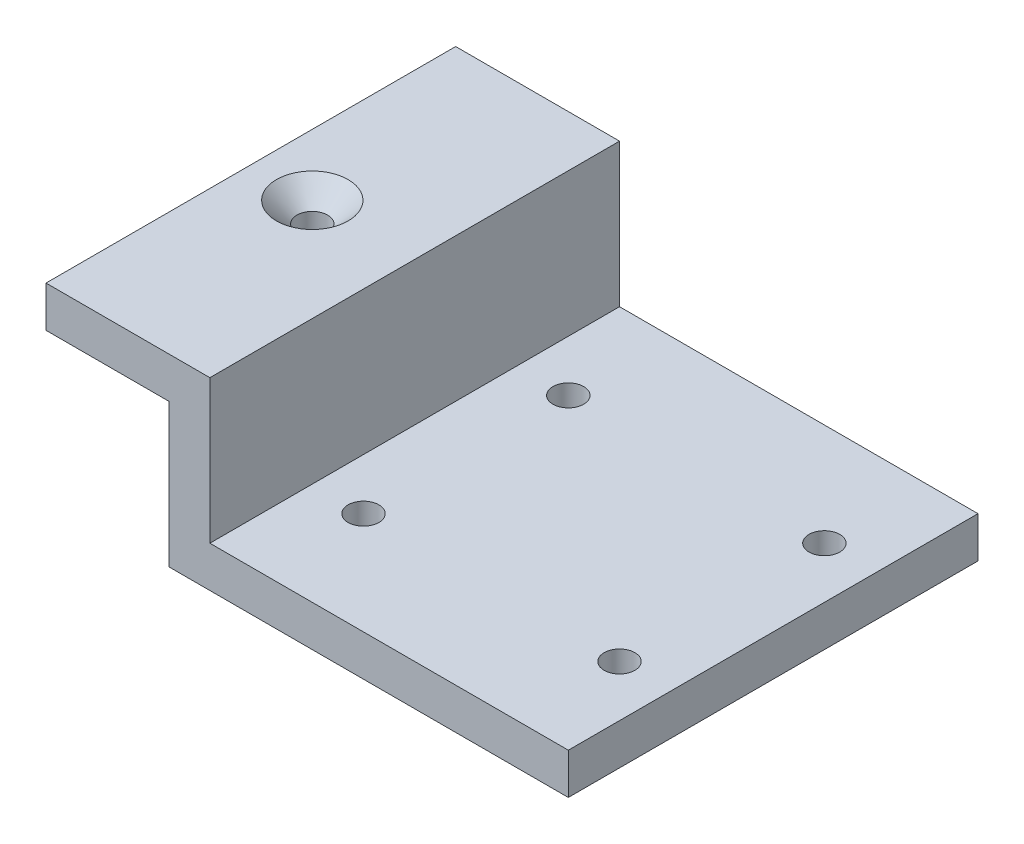
from build123d import *

# Parameters (mm, degrees)
SKETCH_1_W          = 35
SKETCH_1_H          = 40
SKETCH_1_R          = 1.5
EXTRUDE_1_DEPTH     = 4
SKETCH_2_W          = 40
SKETCH_2_H          = 18
EXTRUDE_2_DEPTH     = 4
SKETCH_3_W          = 40
SKETCH_3_H          = 4
EXTRUDE_3_DEPTH     = 12
CUT_EXTRUDE_1_REACH = 44.968
SKETCH_4_R          = 1.5
CHAMFER_1_SIZE      = 2


with BuildPart() as part:
    # 草图1 → 凸台-拉伸1 (new body)
    with BuildSketch(Plane(origin=(0, 0, 0), x_dir=(1, 0, 0), z_dir=(0, 1, 0))):
        Rectangle(SKETCH_1_W, SKETCH_1_H)
        with Locations(Location((12.5, 10, 0), (0, 0, 270))):
            Circle(SKETCH_1_R, mode=Mode.SUBTRACT)
        with Locations(Location((-12.5, 10, 0), (0, 0, 90))):
            Circle(SKETCH_1_R, mode=Mode.SUBTRACT)
        with Locations(Location((-12.5, -10, 0), (0, 0, 270))):
            Circle(SKETCH_1_R, mode=Mode.SUBTRACT)
        with Locations(Location((12.5, -10, 0), (0, 0, 90))):
            Circle(SKETCH_1_R, mode=Mode.SUBTRACT)
    extrude(amount=EXTRUDE_1_DEPTH)

    # 草图2 → 凸台-拉伸2 (add)
    with BuildSketch(Plane.ZY.offset(17.5)):
        with Locations((0, 9)):
            Rectangle(SKETCH_2_W, SKETCH_2_H)
    extrude(amount=EXTRUDE_2_DEPTH)

    # 草图3 → 凸台-拉伸3 (add)
    with BuildSketch(Plane.ZY.offset(21.5)):
        with Locations((0, 16)):
            Rectangle(SKETCH_3_W, SKETCH_3_H)
    extrude(amount=EXTRUDE_3_DEPTH)

    # 草图4 → 切除-拉伸1 (cut, up to next)
    with BuildSketch(Plane(origin=(0, 18, 0), x_dir=(1, 0, 0), z_dir=(0, 1, 0)), mode=Mode.PRIVATE) as cut_extrude_1_sk1:
        with Locations(Location((-27.5, 0, 0), (0, 0, 270))):
            Circle(SKETCH_4_R)
    cut_extrude_1_tool1 = extrude(cut_extrude_1_sk1.sketch, amount=-CUT_EXTRUDE_1_REACH, mode=Mode.PRIVATE) & part.part
    add(cut_extrude_1_tool1.solids().sort_by_distance((-27.5, 18, 0))[0], mode=Mode.SUBTRACT)

    # 倒角1
    chamfer_1_edges = [part.edges().sort_by_distance(p)[0] for p in [
        (-27.5, 18, -1.5),
    ]]
    chamfer(chamfer_1_edges, length=CHAMFER_1_SIZE)


solid = part.part
